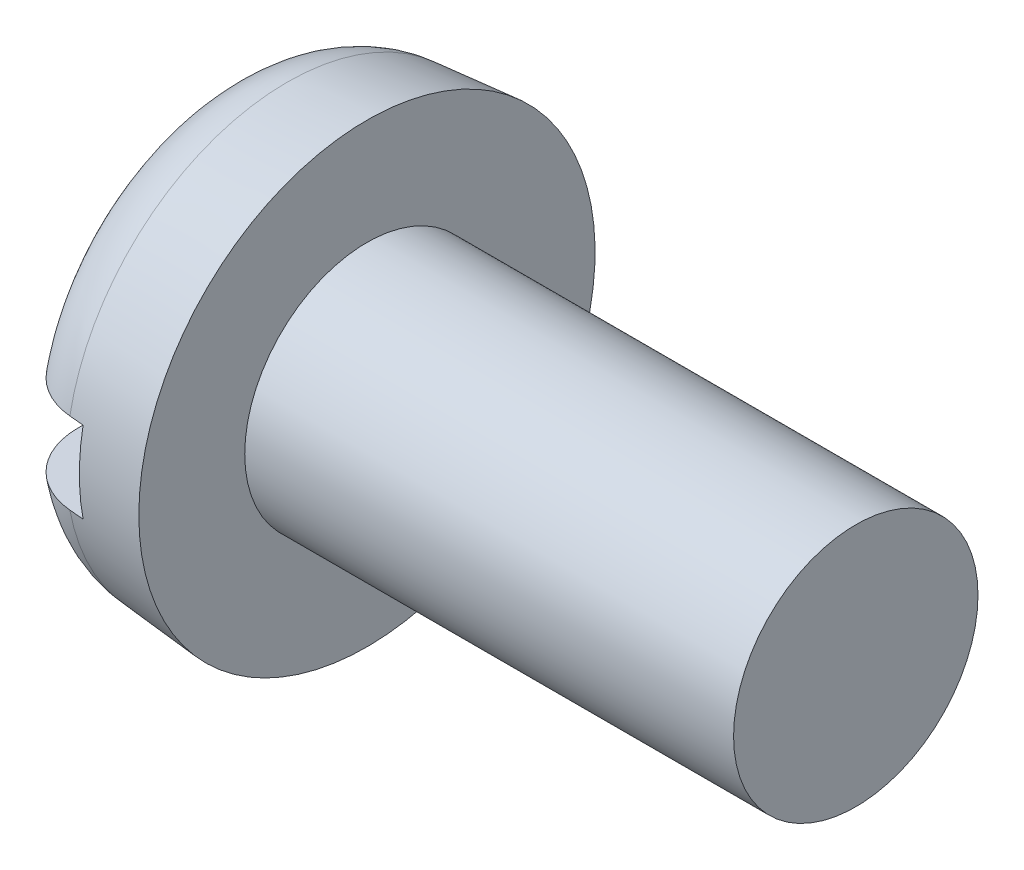
from build123d import *

# Parameters (mm, degrees)
ESQUISSE2_R             = 1.5
BOSS_EXTRU_1_DEPTH      = 6
ENL_V_MAT_EXTRU_1_DEPTH = 0.5


with BuildPart() as part:
    # Esquisse1 → Révolution1 (revolve)
    with BuildSketch(Plane(origin=(0, 0, 0), x_dir=(-1, 0, 0), z_dir=(0, 0, -1)), mode=Mode.PRIVATE) as r_volution1_sk:
        with BuildLine():
            Line((-1.8, 2.8), (-1.8, 0))
            Line((-1.8, 0), (0, 0))
            Line((0, 0), (0, 1.817822349))
            ThreePointArc((0, 1.817822349), (-0.236450397, 2.425853536), (-0.821559832, 2.714397577))
            Line((-0.821559832, 2.714397577), (-1.8, 2.8))
        make_face()
    revolve(r_volution1_sk.sketch.rotate(Axis((1.8, 0, 0), (-1, 0, 0)), 270), axis=Axis((1.8, 0, 0), (-1, 0, 0)))

    # Esquisse2 → Boss.-Extru.1 (add)
    with BuildSketch(Plane(origin=(1.8, 0, 0), x_dir=(0, 0, -1), z_dir=(1, 0, 0))):
        Circle(ESQUISSE2_R)
    extrude(amount=BOSS_EXTRU_1_DEPTH)

    # Esquisse3 → Enlèv. mat.-Extru.1 (cut, symmetric)
    with BuildSketch(Plane(origin=(0, 0, 0), x_dir=(1, 0, 0), z_dir=(0, 1, 0))):
        with BuildLine():
            Line((0, 1.817822349), (0, -1.817822349))
            ThreePointArc((0, -1.817822349), (0.236450397, -2.425853536), (0.821559832, -2.714397577))
            Line((0.821559832, -2.714397577), (1, -2.730009069))
            Line((1, -2.730009069), (1, 2.730009069))
            Line((1, 2.730009069), (0.821559832, 2.714397577))
            ThreePointArc((0.821559832, 2.714397577), (0.236450397, 2.425853536), (0, 1.817822349))
        make_face()
    extrude(amount=ENL_V_MAT_EXTRU_1_DEPTH, both=True, mode=Mode.SUBTRACT)


solid = part.part
